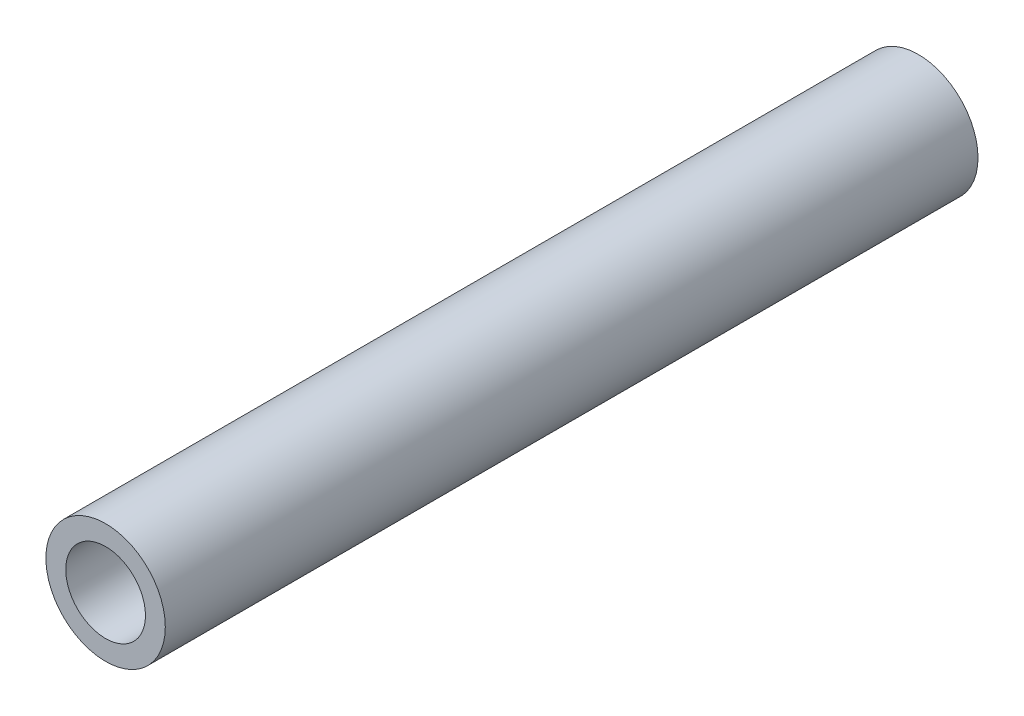
from build123d import *

# Parameters (mm, degrees)
SKETCH1_R           = 11.90625
SKETCH1_R_2         = 7.9502
BOSS_EXTRUDE1_DEPTH = 162.052


with BuildPart() as part:
    # Sketch1 → Boss-Extrude1 (new body)
    with BuildSketch(Plane.XY):
        Circle(SKETCH1_R)
        Circle(SKETCH1_R_2, mode=Mode.SUBTRACT)
    extrude(amount=BOSS_EXTRUDE1_DEPTH)


solid = part.part
